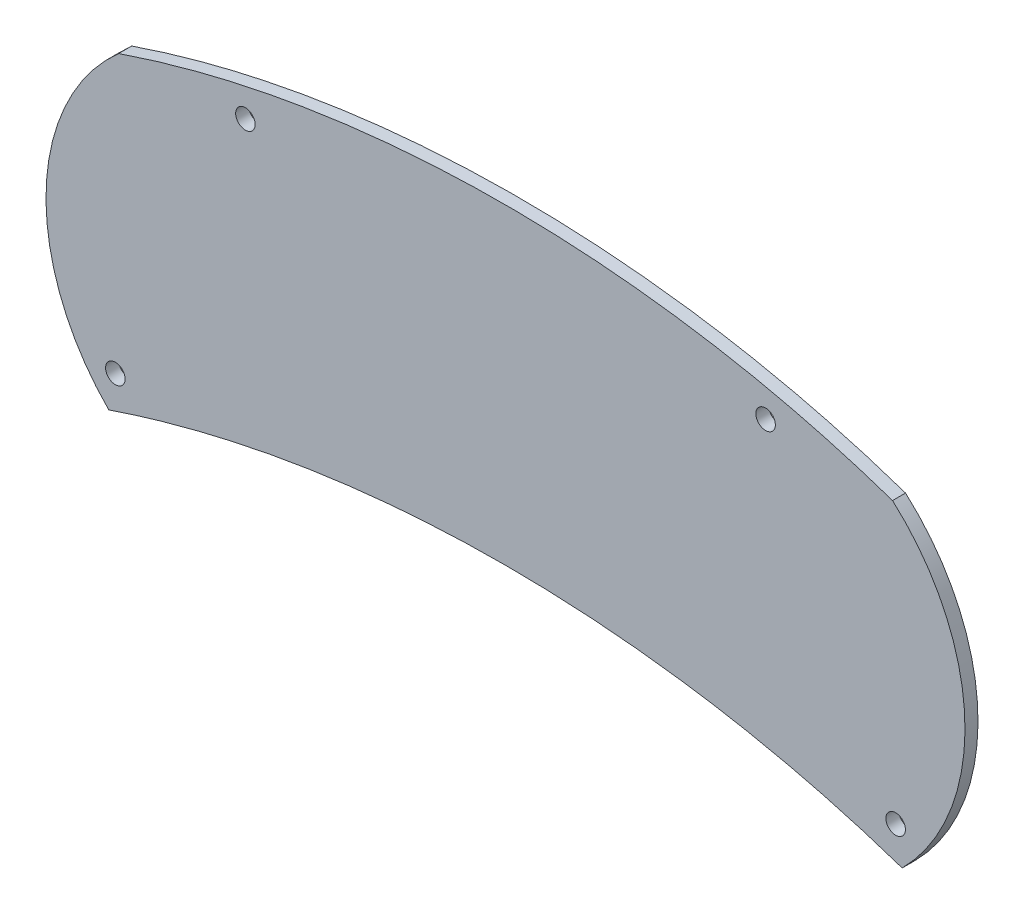
from build123d import *

# Parameters (mm, degrees)
CROQUIS1_R              = 2.25
SALIENTE_EXTRUIR1_DEPTH = 3


with BuildPart() as part:
    # Croquis1 → Saliente-Extruir1 (new body)
    with BuildSketch(Plane(origin=(0, 0, 0), x_dir=(-1, 0, 0), z_dir=(0, 0, 1))):
        with BuildLine():
            ThreePointArc((89.230623206, -116.44830451), (105.975312976, -80.770154924), (91.510495129, -44.10840322))
            add(Edge.make_bspline(
                [(91.510495129, -44.10840322), (84.127759627, -46.626480737), (76.659755812, -48.793582277), (61.567714608, -52.485529927), (53.943636753, -54.010209481), (42.395431338, -55.835856743), (38.534661436, -56.365996553), (30.807441475, -57.271160746), (26.938391186, -57.646594701), (15.315156999, -58.544821608), (7.544966548, -58.840628212), (-2.194410299, -58.832626174), (-4.144610508, -58.812018876), (-8.036264676, -58.733045352), (-9.978956608, -58.674697545), (-15.797685427, -58.443422776), (-19.664385347, -58.214324696), (-31.227228522, -57.302895154), (-38.886271373, -56.397367959), (-54.103241252, -53.978001601), (-61.66117651, -52.464211948), (-76.669501884, -48.789641951), (-84.119939601, -46.629147964), (-91.510495129, -44.10840322)],
                knots=[0, 0, 0, 0, 0.125, 0.125, 0.25, 0.25, 0.3125, 0.3125, 0.375, 0.375, 0.5, 0.5, 0.53125, 0.53125, 0.5625, 0.5625, 0.625, 0.625, 0.75, 0.75, 0.875, 0.875, 1, 1, 1, 1], degree=3))
            ThreePointArc((-91.510495129, -44.10840322), (-105.976396022, -80.735404374), (-89.282652322, -116.402173549))
            add(Edge.make_bspline(
                [(-89.282652322, -116.402173549), (-82.084427391, -118.871103079), (-74.801680613, -120.994537875), (-60.082232302, -124.612096128), (-52.645335382, -126.10542091), (-41.379555775, -127.893992917), (-37.614074487, -128.413191154), (-30.076442699, -129.300162486), (-26.302159817, -129.668099271), (-14.963168802, -130.548836526), (-7.382405934, -130.839774929), (2.120284858, -130.833963635), (4.022505287, -130.814238018), (7.817943392, -130.737887871), (13.501947355, -130.568056968), (19.158656691, -130.233305689), (30.435872975, -129.345060023), (37.90580458, -128.46158479), (52.74714565, -126.099341043), (60.118593514, -124.620804538), (74.756372315, -121.028591029), (82.022853845, -118.915823941), (89.230623206, -116.44830451)],
                knots=[0, 0, 0, 0, 0.125, 0.125, 0.25, 0.25, 0.3125, 0.3125, 0.375, 0.375, 0.5, 0.5, 0.53125, 0.53125, 0.5625, 0.625, 0.625, 0.75, 0.75, 0.875, 0.875, 1, 1, 1, 1], degree=3))
        make_face()
        with Locations(Location((90, -52.150876122, 0), (0, 0, 180))):
            Circle(CROQUIS1_R, mode=Mode.SUBTRACT)
        with Locations(Location((60, -118, 0), (0, 0, 180))):
            Circle(CROQUIS1_R, mode=Mode.SUBTRACT)
        with Locations(Location((-60, -118, 0), (0, 0, 180))):
            Circle(CROQUIS1_R, mode=Mode.SUBTRACT)
        with Locations(Location((-90, -52.150876122, 0), (0, 0, 180))):
            Circle(CROQUIS1_R, mode=Mode.SUBTRACT)
    extrude(amount=SALIENTE_EXTRUIR1_DEPTH)


solid = part.part
